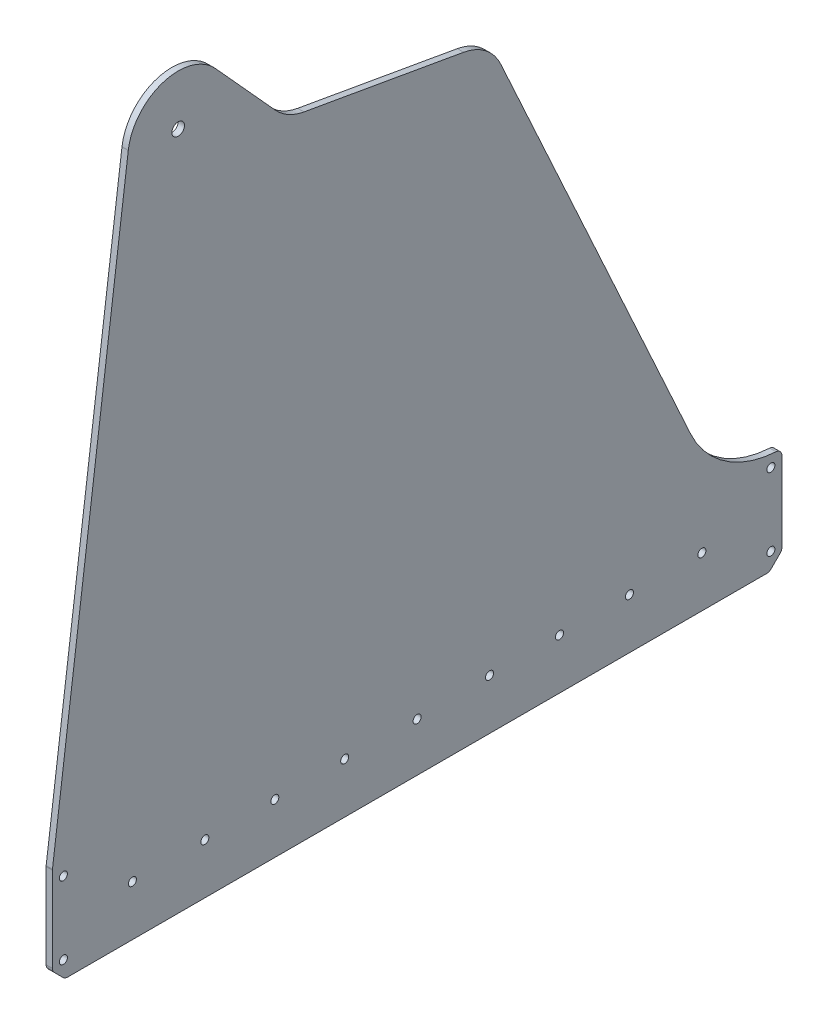
from build123d import *

# Parameters (mm, degrees)
PLATE_DEPTH                = 3.175
DRIVE_HOLES_D              = 4.064
SKETCH3_R                  = 3.175
TUBE_PIVOT_HOLES_DEPTH     = 521.864531932
BOTTOM_CORNER_CHAMFER_SIZE = 6.35
BOTTOM_CORNER_FILLET_R     = 3.175
CARBON_CAP_HOLES_D         = 4.064


with BuildPart() as part:
    # Sketch2 → Plate (new body)
    with BuildSketch(Plane(origin=(0, 0, 0), x_dir=(0, 0, -1), z_dir=(1, 0, 0))):
        with BuildLine():
            Line((0, 0), (0, 50.8))
            Line((0, 50.8), (38.311002826, 346.167173299))
            ThreePointArc((38.311002826, 346.167173299), (55.900445741, 367.136476127), (82.313788673, 359.96462293))
            Line((82.313788673, 359.96462293), (112.596875039, 326.577445868))
            ThreePointArc((112.596875039, 326.577445868), (119.137016705, 321.404317358), (127, 318.627951872))
            Line((127, 318.627951872), (207.610663713, 304.414116927))
            ThreePointArc((207.610663713, 304.414116927), (218.737141463, 299.493711333), (226.299177538, 289.963522))
            Line((226.299177538, 289.963522), (322.101644923, 80.472956))
            ThreePointArc((322.101644923, 80.472956), (340.846528773, 58.857200401), (368.3, 50.8))
            Line((368.3, 50.8), (368.3, 0))
            Line((368.3, 0), (0, 0))
        make_face()
    extrude(amount=PLATE_DEPTH)

    # Drive Holes (through all)
    with Locations(Plane(origin=(3.175, 0, 0), x_dir=(0, 0, -1), z_dir=(1, 0, 0))):
        with Locations((184.15, 24.60625), (220.717386247, 25.4), (256.023386247, 25.4), (291.329386247, 25.4), (327.905386247, 25.4), (147.582613753, 25.4), (112.276613753, 25.4), (76.970613753, 25.4), (40.394613753, 25.4)):
            Hole(DRIVE_HOLES_D / 2)

    # Sketch3 → Tube Pivot Holes (cut, through all)
    with BuildSketch(Plane(origin=(3.175, 0, 0), x_dir=(0, 0, -1), z_dir=(1, 0, 0))):
        with Locations((63.5, 342.9)):
            Circle(SKETCH3_R)
    extrude(amount=-TUBE_PIVOT_HOLES_DEPTH, mode=Mode.SUBTRACT)

    # Bottom Corner Chamfer
    bottom_corner_chamfer_edges = [part.edges().sort_by_distance(p)[0] for p in [
        (1.5875, 0, 0),
        (1.5875, 0, -368.3),
    ]]
    chamfer(bottom_corner_chamfer_edges, length=BOTTOM_CORNER_CHAMFER_SIZE)

    # Bottom Corner Fillet
    bottom_corner_fillet_edges = [part.edges().sort_by_distance(p)[0] for p in [
        (1.5875, 0, -6.35),
        (1.5875, 0, -361.95),
        (1.5875, 6.35, 0),
        (1.5875, 50.8, 0),
        (1.5875, 50.8, -368.3),
        (1.5875, 6.35, -368.3),
    ]]
    fillet(bottom_corner_fillet_edges, radius=BOTTOM_CORNER_FILLET_R)

    # Carbon Cap Holes (through all)
    with Locations(Plane(origin=(3.175, 0, 0), x_dir=(0, 0, -1), z_dir=(1, 0, 0))):
        with Locations((5.55625, 45.24375), (5.55625, 8.651474106), (362.74375, 45.24375), (362.74375, 8.651474106)):
            Hole(CARBON_CAP_HOLES_D / 2)


solid = part.part
